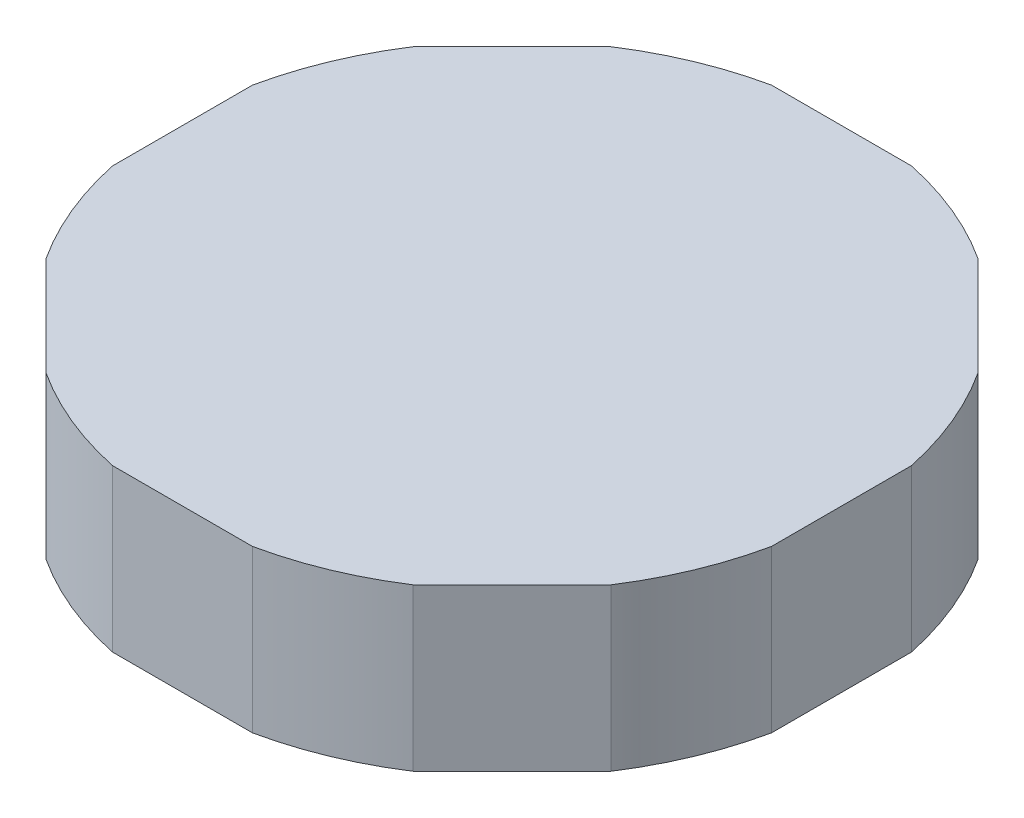
from build123d import *

# Parameters (mm, degrees)
SKETCH1_R           = 6.257840103
BOSS_EXTRUDE1_DEPTH = 3
SKETCH2_R           = 8.121320344
CUT_EXTRUDE1_DEPTH  = 10.344577331


with BuildPart() as part:
    # Sketch1 → Boss-Extrude1 (new body)
    with BuildSketch(Plane(origin=(0, 0, 0), x_dir=(1, 0, 0), z_dir=(0, 1, 0))):
        with Locations(Location((0, 0, 0), (0, 0, 270))):
            Circle(SKETCH1_R)
    extrude(amount=BOSS_EXTRUDE1_DEPTH)

    # Sketch2 → Cut-Extrude1 (cut, through all)
    with BuildSketch(Plane(origin=(0, 3, 0), x_dir=(1, 0, 0), z_dir=(0, 1, 0))):
        Circle(SKETCH2_R)
        Polygon((6.121320344, -2.535533906), (6.121320344, 2.535533906), (2.535533906, 6.121320344), (-2.535533906, 6.121320344), (-6.121320344, 2.535533906), (-6.121320344, -2.535533906), (-2.535533906, -6.121320344), (2.535533906, -6.121320344), align=None, mode=Mode.SUBTRACT)
    extrude(amount=-CUT_EXTRUDE1_DEPTH, mode=Mode.SUBTRACT)


solid = part.part
